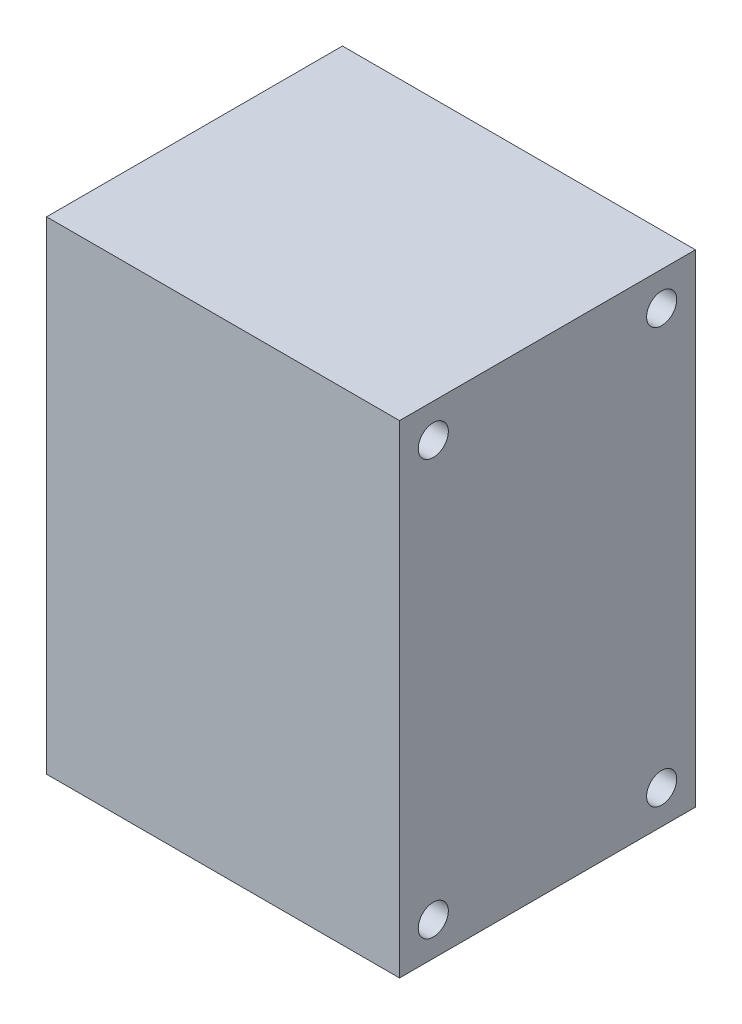
from build123d import *

# Parameters (mm, degrees)
SKETCH1_W           = 34
SKETCH1_H           = 46.5
BOSS_EXTRUDE1_DEPTH = 28.5
SKETCH2_R           = 1.45
CUT_EXTRUDE1_DEPTH  = 51.088047476


with BuildPart() as part:
    # Sketch1 → Boss-Extrude1 (new body)
    with BuildSketch(Plane.XY):
        Rectangle(SKETCH1_W, SKETCH1_H)
    extrude(amount=BOSS_EXTRUDE1_DEPTH)

    # Sketch2 → Cut-Extrude1 (cut, through all)
    with BuildSketch(Plane(origin=(17, 0, 0), x_dir=(0, 0, -1), z_dir=(1, 0, 0))):
        with Locations(Location((-25.25, 20, 0), (0, 0, 90))):
            Circle(SKETCH2_R)
        with Locations(Location((-3.25, 20, 0), (0, 0, 90))):
            Circle(SKETCH2_R)
        with Locations(Location((-3.25, -20, 0), (0, 0, 90))):
            Circle(SKETCH2_R)
        with Locations(Location((-25.25, -20, 0), (0, 0, 90))):
            Circle(SKETCH2_R)
    extrude(amount=-CUT_EXTRUDE1_DEPTH, mode=Mode.SUBTRACT)


solid = part.part
